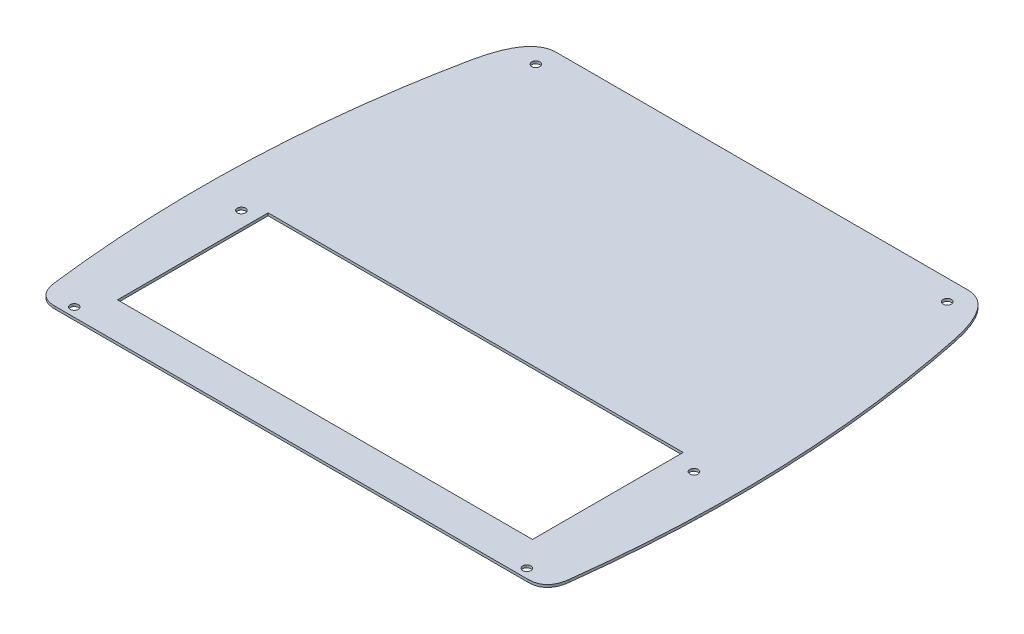
from build123d import *

# Parameters (mm, degrees)
BOSS_EXTRUDE1_DEPTH = 1
SKETCH2_R           = 1.6
SKETCH2_W           = 161.4
SKETCH2_H           = 58.6
CUT_EXTRUDE1_DEPTH  = 211.355512163


with BuildPart() as part:
    # Sketch1 → Boss-Extrude1 (new body)
    with BuildSketch(Plane(origin=(0, 0, 0), x_dir=(1, 0, 0), z_dir=(0, 1, 0))):
        with BuildLine():
            Line((92, 0), (-92, 0))
            add(Edge.make_bspline(
                [(-92, 0), (-99, 0), (-100, 8)],
                knots=[0, 0, 0, 1, 1, 1], degree=2))
            add(Edge.make_bspline(
                [(-100, 8), (-109.749547472, 87.403692131), (-94, 164)],
                knots=[0, 0, 0, 1, 1, 1], degree=2))
            add(Edge.make_bspline(
                [(-94, 164), (-90, 183), (-80, 183)],
                knots=[0, 0, 0, 1, 1, 1], degree=2))
            Line((-80, 183), (80, 183))
            add(Edge.make_bspline(
                [(94, 164), (90, 183), (80, 183)],
                knots=[0, 0, 0, 1, 1, 1], degree=2))
            add(Edge.make_bspline(
                [(100, 8), (109.749547472, 87.403692131), (94, 164)],
                knots=[0, 0, 0, 1, 1, 1], degree=2))
            add(Edge.make_bspline(
                [(92, 0), (99, 0), (100, 8)],
                knots=[0, 0, 0, 1, 1, 1], degree=2))
        make_face()
    extrude(amount=BOSS_EXTRUDE1_DEPTH)

    # Sketch2 → Cut-Extrude1 (cut, through all)
    with BuildSketch(Plane(origin=(0, 1, 0), x_dir=(1, 0, 0), z_dir=(0, 1, 0))):
        with Locations(Location((-88, 3.5, 0), (0, 0, 270))):
            Circle(SKETCH2_R)
        with Locations(Location((88, 3.5, 0), (0, 0, 90))):
            Circle(SKETCH2_R)
        with Locations(Location((-80, 175, 0), (0, 0, 270))):
            Circle(SKETCH2_R)
        with Locations(Location((80, 175, 0), (0, 0, 90))):
            Circle(SKETCH2_R)
        with Locations(Location((-88, 68.5, 0), (0, 0, 270))):
            Circle(SKETCH2_R)
        with Locations(Location((88, 68.5, 0), (0, 0, 270))):
            Circle(SKETCH2_R)
        with Locations((-1.3, 43.6)):
            Rectangle(SKETCH2_W, SKETCH2_H)
    extrude(amount=-CUT_EXTRUDE1_DEPTH, mode=Mode.SUBTRACT)


solid = part.part
